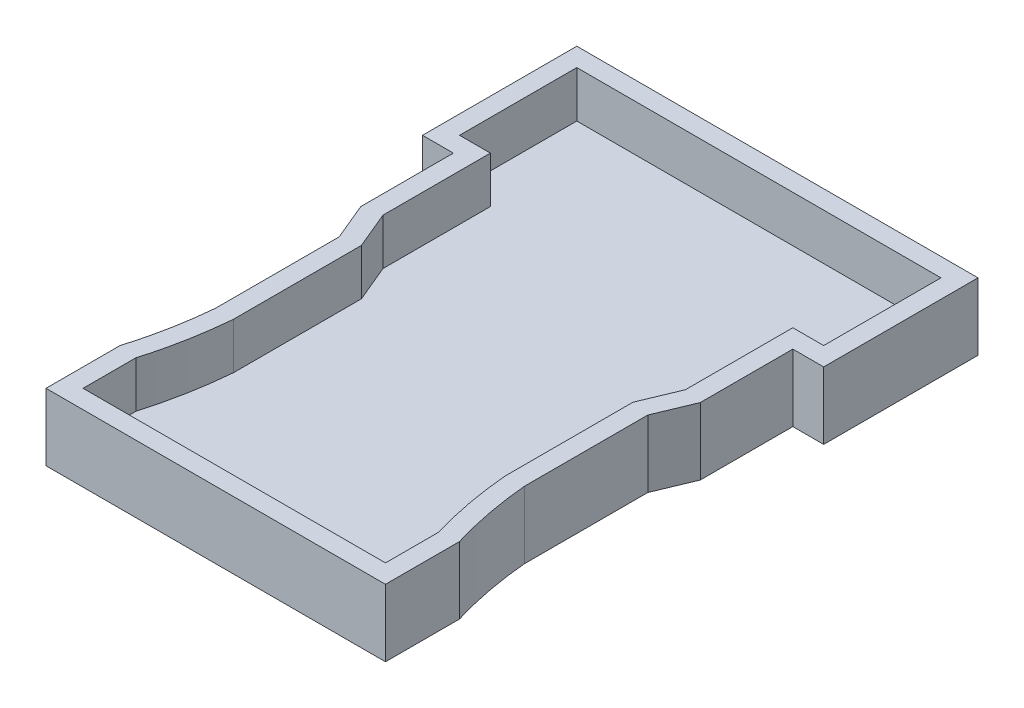
from build123d import *

# Parameters (mm, degrees)
BOSS_EXTRUDE1_DEPTH = 18.415
CUT_EXTRUDE1_DEPTH  = 12.7


with BuildPart() as part:
    # Sketch3 → Boss-Extrude1 (new body)
    with BuildSketch(Plane(origin=(0, 0, 0), x_dir=(1, 0, 0), z_dir=(0, 1, 0))):
        with BuildLine():
            Line((101.599873, 0), (110.066582, 0))
            Line((110.066582, 0), (110.066582, 42.333418))
            Line((110.066582, 42.333418), (55.033291, 42.333418))
            Line((55.033291, 42.333418), (8.4666328, 42.333418))
            Line((8.4666328, 42.333418), (0, 42.333418))
            Line((0, 42.333418), (0, 0))
            Line((0, 0), (8.4666328, 0))
            Line((8.4666328, 0), (8.4666328, -25.4))
            Line((8.4666328, -25.4), (12.6999492, -35.56))
            Line((12.6999492, -35.56), (12.6999492, -69.426582))
            add(Edge.make_bspline(
                [(12.6999492, -69.426582), (11.690404189, -80.766544706), (8.46666328, -91.44)],
                knots=[0, 0, 0, 0.504540069, 0.504540069, 0.504540069], degree=2))
            Line((8.46666328, -91.44), (8.46666328, -111.76))
            Line((8.46666328, -111.76), (101.599995682, -111.76))
            Line((101.599995682, -111.76), (101.599995682, -91.44))
            add(Edge.make_bspline(
                [(97.366709, -69.426582), (98.376270675, -80.766537876), (101.599995682, -91.44)],
                knots=[0, 0, 0, 0.504540407, 0.504540407, 0.504540407], degree=2))
            Line((97.366709, -69.426582), (97.366709, -35.56))
            Line((97.366709, -35.56), (101.599873, -25.4))
            Line((101.599873, -25.4), (101.599873, 0))
        make_face()
    extrude(amount=BOSS_EXTRUDE1_DEPTH)

    # Sketch7 → Cut-Extrude1 (cut)
    with BuildSketch(Plane(origin=(0, 18.415, 0), x_dir=(1, 0, 0), z_dir=(0, 1, 0))):
        with BuildLine():
            Line((104.986582, 5.08), (104.986582, 37.253418))
            Line((104.986582, 37.253418), (5.08, 37.253418))
            Line((5.08, 37.253418), (5.08, 5.08))
            Line((5.08, 5.08), (13.5466328, 5.08))
            Line((13.5466328, 5.08), (13.5466328, -24.384003751))
            Line((13.5466328, -24.384003751), (17.7799492, -34.544003751))
            Line((17.7799492, -34.544003751), (17.7799492, -69.649806794))
            add(Edge.make_bspline(
                [(13.54666328, -92.18157962), (15.696718758, -84.885689198), (17.107633166, -77.368389863), (17.7799492, -69.649806794)],
                knots=[0, 0, 0, 0, 1, 1, 1, 1], degree=3))
            Line((13.54666328, -92.18157962), (13.54666328, -106.68))
            Line((13.54666328, -106.68), (96.519995682, -106.68))
            Line((96.519995682, -106.68), (96.519995682, -92.1815758))
            add(Edge.make_bspline(
                [(92.286709, -69.649810631), (92.959036165, -77.368387225), (94.369950858, -84.885683715), (96.519995682, -92.1815758)],
                knots=[0, 0, 0, 0, 1, 1, 1, 1], degree=3))
            Line((92.286709, -69.649810631), (92.286709, -34.544037514))
            Line((92.286709, -34.544037514), (96.519873, -24.384037514))
            Line((96.519873, -24.384037514), (96.519873, 5.08))
            Line((96.519873, 5.08), (104.986582, 5.08))
        make_face()
    extrude(amount=-CUT_EXTRUDE1_DEPTH, mode=Mode.SUBTRACT)


solid = part.part
